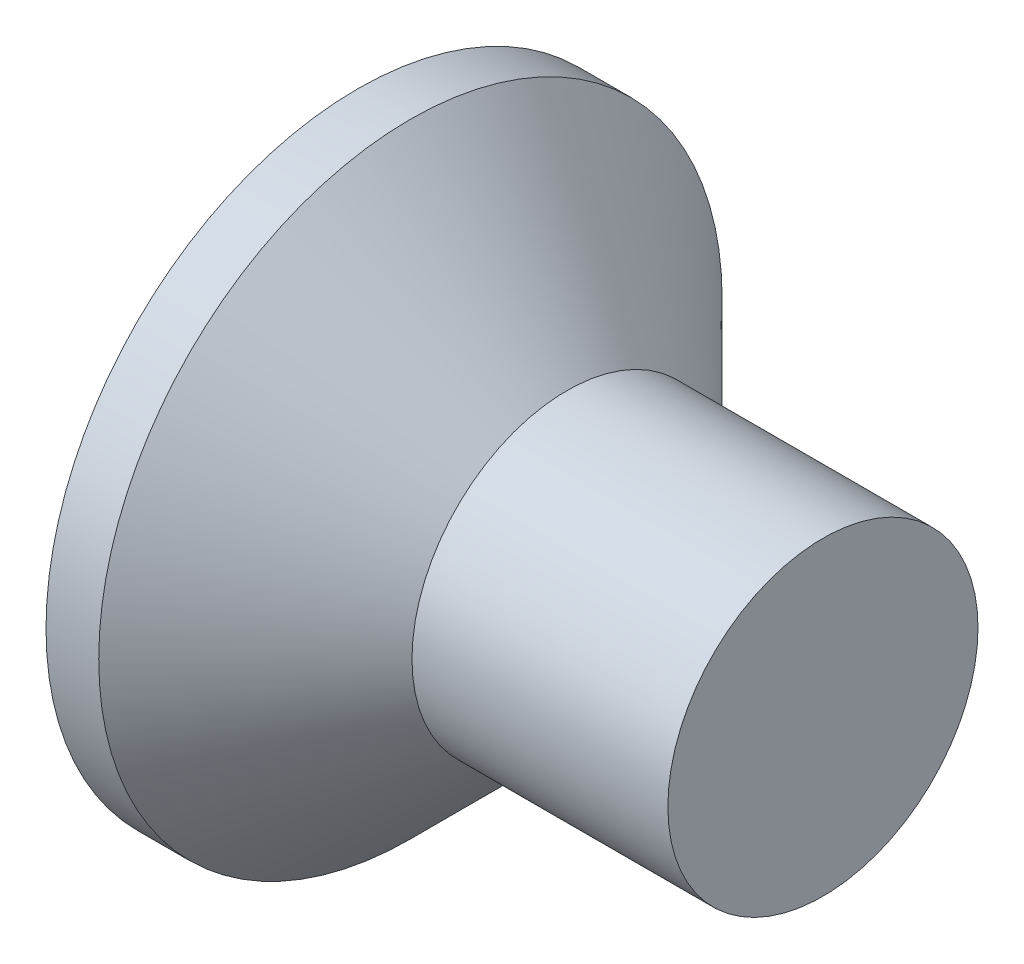
from build123d import *

# Parameters (mm, degrees)
CROSSRECESS_DEPTH = 1.35
DRAFT9_ANGLE      = 30
FILLET5_R         = 0.3


with BuildPart() as part:
    # Sketch1 → Base (revolve)
    with BuildSketch(Plane.XY, mode=Mode.PRIVATE) as base_sk:
        Polygon((6, 2), (4.1, 2), (2.7, 2), (0.68, 4.02), (0, 4.02), (0, 0), (6, 0), align=None)
    revolve(base_sk.sketch.rotate(Axis((4.515812911, 0, 0), (-1, 0, 0)), 90), axis=Axis((4.515812911, 0, 0), (-1, 0, 0)))

    # Sketch6 → CrossRecess (cut)
    with BuildSketch(Plane(origin=(0, 0, 0), x_dir=(0, 0, -1), z_dir=(1, 0, 0))):
        Polygon((0.46, 0.46), (0.46, 2.3), (-0.46, 2.3), (-0.46, 0.46), (-2.3, 0.46), (-2.3, -0.46), (-0.46, -0.46), (-0.46, -2.3), (0.46, -2.3), (0.46, -0.46), (2.3, -0.46), (2.3, 0.46), align=None)
    extrude(amount=CROSSRECESS_DEPTH, mode=Mode.SUBTRACT)

    # Draft9
    draft9_faces = [part.faces().sort_by_distance(p)[0] for p in [
        (0.675, 2.3, 0),
        (0.675, 0, 2.3),
        (0.675, -2.3, 0),
        (0.675, 0, -2.3),
    ]]
    draft(draft9_faces, Plane(origin=(0, 4.02, 0), x_dir=(0, 0, -1), z_dir=(-1, 0, 0)), DRAFT9_ANGLE)

    # Fillet5
    fillet5_edges = [part.edges().sort_by_distance(p)[0] for p in [
        (0.675, 0.46, 0.46),
        (0.675, -0.46, 0.46),
        (0.675, -0.46, -0.46),
        (0.675, 0.46, -0.46),
    ]]
    fillet(fillet5_edges, radius=FILLET5_R)


solid = part.part
